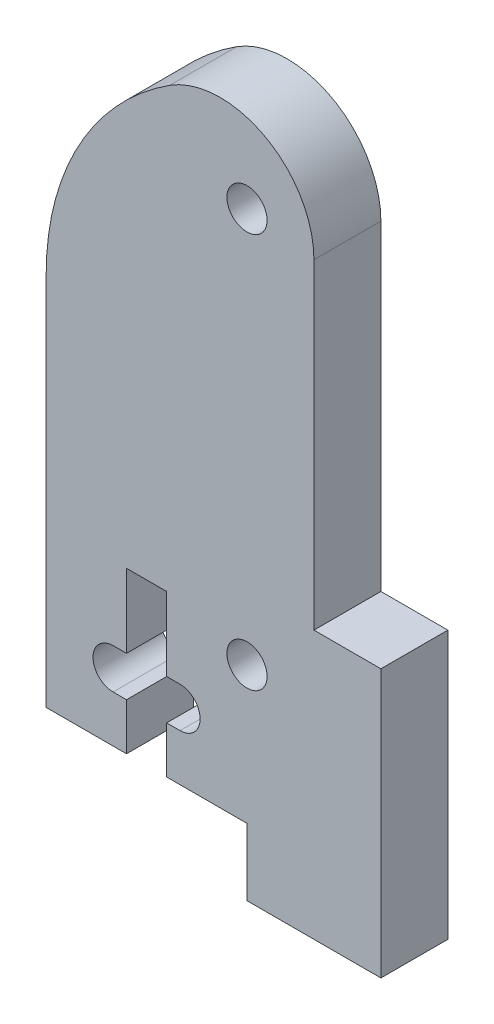
from build123d import *

# Parameters (mm, degrees)
BOSS_EXTRUDE1_DEPTH = 5
SKETCH2_W           = 3
SKETCH2_H           = 12
CUT_EXTRUDE1_DEPTH  = 10
FILLET1_R           = 7
SKETCH3_R           = 1.5
CUT_EXTRUDE2_DEPTH  = 10


with BuildPart() as part:
    # Sketch1 → Boss-Extrude1 (new body)
    with BuildSketch(Plane.XY):
        with BuildLine():
            Line((13.600261452, -32.359372515), (13.600261452, -12.359372515))
            Line((13.600261452, -12.359372515), (8.600261452, -12.359372515))
            Line((8.600261452, -12.359372515), (8.600261452, 20.640627485))
            ThreePointArc((8.600261452, 20.640627485), (-5.541874172, 14.782763108), (-11.399738548, 0.640627485))
            Line((-11.399738548, 0.640627485), (-11.399738548, -27.359372515))
            Line((-11.399738548, -27.359372515), (3.600261452, -27.359372515))
            Line((3.600261452, -27.359372515), (3.600261452, -32.359372515))
            Line((3.600261452, -32.359372515), (13.600261452, -32.359372515))
        make_face()
    extrude(amount=BOSS_EXTRUDE1_DEPTH)

    # Sketch2 → Cut-Extrude1 (cut)
    with BuildSketch(Plane.XY.offset(5)):
        with Locations((-3.899738548, -21.359372515)):
            Rectangle(SKETCH2_W, SKETCH2_H)
        with BuildLine():
            Line((-6.399738548, -20.859372515), (-1.399738548, -20.859372515))
            ThreePointArc((-1.399738548, -20.859372515), (0.100261452, -22.359372515), (-1.399738548, -23.859372515))
            Line((-1.399738548, -23.859372515), (-6.399738548, -23.859372515))
            ThreePointArc((-6.399738548, -23.859372515), (-7.899738548, -22.359372515), (-6.399738548, -20.859372515))
        make_face()
    extrude(amount=-CUT_EXTRUDE1_DEPTH, mode=Mode.SUBTRACT)

    # Fillet1
    fillet1_edges = [part.edges().sort_by_distance(p)[0] for p in [
        (8.600261452, 20.640627485, 2.5),
    ]]
    fillet(fillet1_edges, radius=FILLET1_R)

    # Sketch3 → Cut-Extrude2 (cut)
    with BuildSketch(Plane.XY.offset(5)):
        with Locations((3.600261452, -17.109372515)):
            Circle(SKETCH3_R)
        with Locations((3.600261452, 12.390627485)):
            Circle(SKETCH3_R)
    extrude(amount=-CUT_EXTRUDE2_DEPTH, mode=Mode.SUBTRACT)


solid = part.part
